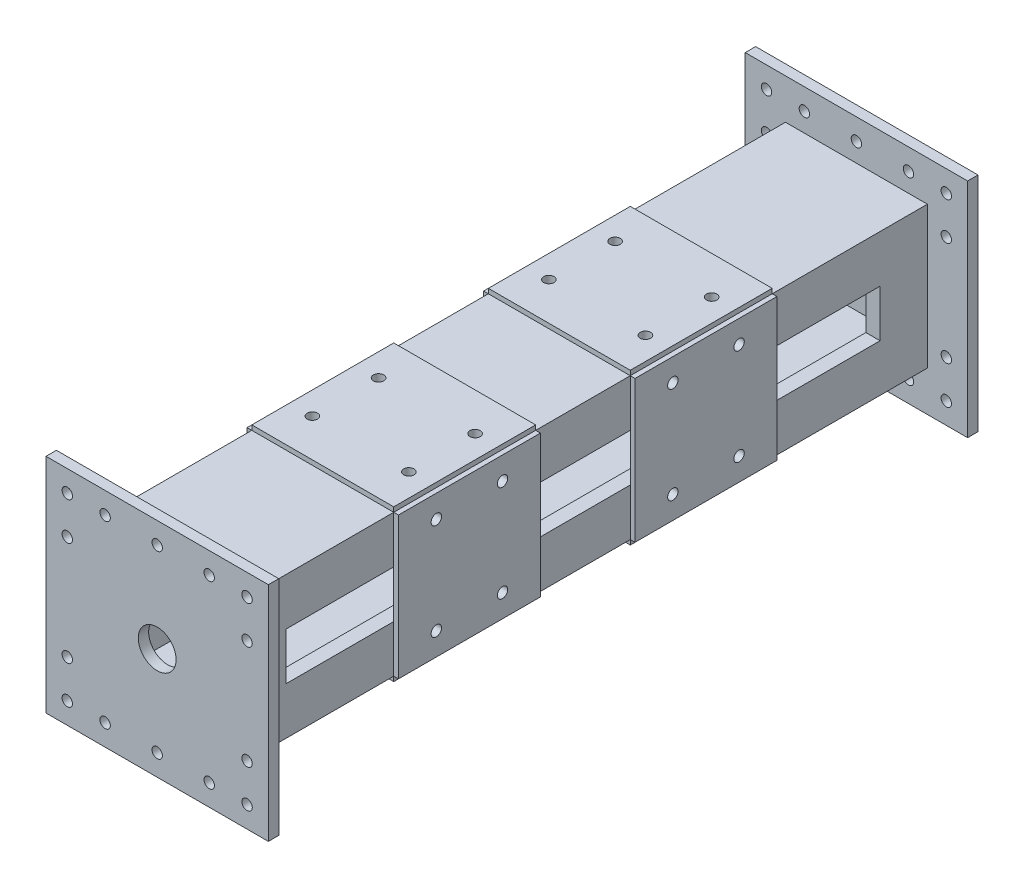
from build123d import *

# Parameters (mm, degrees)
SKETCH_1_W                       = 300
SKETCH_1_H                       = 300
EXTRUDE_1_DEPTH                  = 1456
SKETCH_2_W                       = 240
SKETCH_2_H                       = 240
CUT_EXTRUDE_1_DEPTH              = 1517.553988488
SKETCH_4_W                       = 1256
SKETCH_4_H                       = 100
CUT_EXTRUDE_2_DEPTH              = 1517.553988488
SKETCH_5_W                       = 470
SKETCH_5_H                       = 470
EXTRUDE_2_DEPTH                  = 22
SKETCH_6_W                       = 470
SKETCH_6_H                       = 470
EXTRUDE_3_DEPTH                  = 22
SKETCH_7_R                       = 11
CUT_EXTRUDE_3_DEPTH              = 1596.760007019
SKETCH_8_W                       = 300
SKETCH_8_H                       = 300
EXTRUDE_4_DEPTH                  = 10
SKETCH_9_W                       = 300
SKETCH_9_H                       = 300
EXTRUDE_5_DEPTH                  = 10
SKETCH_10_W                      = 300
SKETCH_10_H                      = 300
EXTRUDE_6_DEPTH                  = 10
SKETCH_11_W                      = 300
SKETCH_11_H                      = 300
EXTRUDE_7_DEPTH                  = 10
SKETCH_12_R                      = 11
CUT_EXTRUDE_4_DEPTH              = 1578.572185353
PATTERN_LINEAR_1_COUNT           = 2
PATTERN_LINEAR_1_PITCH           = 140
PATTERN_LINEAR_1_COUNT_DIR2      = 2
PATTERN_LINEAR_1_PITCH_DIR2      = 204
PATTERN_LINEAR_2_COUNT           = 2
PATTERN_LINEAR_2_PITCH           = 500
PATTERN_LINEAR_2_COPY_1_SKETCH_R = 11
PATTERN_LINEAR_2_COPY_1_DEPTH    = 1578.572185353
PATTERN_LINEAR_2_COPY_2_SKETCH_R = 11
PATTERN_LINEAR_2_COPY_2_DEPTH    = 1578.572185353
PATTERN_LINEAR_2_COPY_3_SKETCH_R = 11
PATTERN_LINEAR_2_COPY_3_DEPTH    = 1578.572185353
SKETCH_13_R                      = 11
CUT_EXTRUDE_5_DEPTH              = 1578.572185353
PATTERN_LINEAR_3_COUNT           = 2
PATTERN_LINEAR_3_PITCH           = 140
PATTERN_LINEAR_3_COUNT_DIR2      = 2
PATTERN_LINEAR_3_PITCH_DIR2      = 204
PATTERN_LINEAR_4_COUNT           = 2
PATTERN_LINEAR_4_PITCH           = 500
PATTERN_LINEAR_4_COPY_1_SKETCH_R = 11
PATTERN_LINEAR_4_COPY_1_DEPTH    = 1578.572185353
PATTERN_LINEAR_4_COPY_2_SKETCH_R = 11
PATTERN_LINEAR_4_COPY_2_DEPTH    = 1578.572185353
PATTERN_LINEAR_4_COPY_3_SKETCH_R = 11
PATTERN_LINEAR_4_COPY_3_DEPTH    = 1578.572185353
SKETCH_14_R                      = 40
CUT_EXTRUDE_6_DEPTH              = 1596.760007019


with BuildPart() as part:
    # 草图1 → 拉伸1 (new body)
    with BuildSketch(Plane.XY):
        with Locations((150, 150)):
            Rectangle(SKETCH_1_W, SKETCH_1_H)
    extrude(amount=EXTRUDE_1_DEPTH)

    # 草图2 → 切除-拉伸1 (cut, through all)
    with BuildSketch(Plane.XY.offset(1456)):
        with Locations((150, 150)):
            Rectangle(SKETCH_2_W, SKETCH_2_H)
    extrude(amount=-CUT_EXTRUDE_1_DEPTH, mode=Mode.SUBTRACT)

    # 草图4 → 切除-拉伸2 (cut, through all)
    with BuildSketch(Plane.ZY):
        with Locations((728, 150)):
            Rectangle(SKETCH_4_W, SKETCH_4_H)
    extrude(amount=-CUT_EXTRUDE_2_DEPTH, mode=Mode.SUBTRACT)

    # 草图5 → 拉伸2 (add)
    with BuildSketch(Plane.XY.offset(1456)):
        with Locations((150, 150)):
            Rectangle(SKETCH_5_W, SKETCH_5_H)
    extrude(amount=EXTRUDE_2_DEPTH)

    # 草图6 → 拉伸3 (add)
    with BuildSketch(Plane(origin=(0, 0, 0), x_dir=(-1, 0, 0), z_dir=(0, 0, -1))):
        with Locations((-150, 150)):
            Rectangle(SKETCH_6_W, SKETCH_6_H)
    extrude(amount=EXTRUDE_3_DEPTH)

    # 草图7 → 切除-拉伸3 (cut, through all)
    with BuildSketch(Plane.XY.offset(1478)):
        with Locations((-40, -40)):
            Circle(SKETCH_7_R)
        with Locations((40, -40)):
            Circle(SKETCH_7_R)
        with Locations((150, -40)):
            Circle(SKETCH_7_R)
        with Locations((260, -40)):
            Circle(SKETCH_7_R)
        with Locations((340, -40)):
            Circle(SKETCH_7_R)
        with Locations((-40, 340)):
            Circle(SKETCH_7_R)
        with Locations((40, 340)):
            Circle(SKETCH_7_R)
        with Locations((150, 340)):
            Circle(SKETCH_7_R)
        with Locations((260, 340)):
            Circle(SKETCH_7_R)
        with Locations((340, 340)):
            Circle(SKETCH_7_R)
        with Locations((-40, 40)):
            Circle(SKETCH_7_R)
        with Locations((-40, 260)):
            Circle(SKETCH_7_R)
        with Locations((340, 40)):
            Circle(SKETCH_7_R)
        with Locations((340, 260)):
            Circle(SKETCH_7_R)
    extrude(amount=-CUT_EXTRUDE_3_DEPTH, mode=Mode.SUBTRACT)

    # 草图8 → 拉伸4 (add)
    with BuildSketch(Plane(origin=(0, 300, 0), x_dir=(1, 0, 0), z_dir=(0, 1, 0))):
        with Locations((150, -478)):
            Rectangle(SKETCH_8_W, SKETCH_8_H)
        with Locations((150, -978)):
            Rectangle(SKETCH_8_W, SKETCH_8_H)
    extrude(amount=EXTRUDE_4_DEPTH)

    # 草图9 → 拉伸5 (add)
    with BuildSketch(Plane.XZ):
        with Locations((150, 478)):
            Rectangle(SKETCH_9_W, SKETCH_9_H)
        with Locations((150, 978)):
            Rectangle(SKETCH_9_W, SKETCH_9_H)
    extrude(amount=EXTRUDE_5_DEPTH)

    # 草图10 → 拉伸6 (add)
    with BuildSketch(Plane(origin=(300, 0, 0), x_dir=(0, 0, -1), z_dir=(1, 0, 0))):
        with Locations((-478, 150)):
            Rectangle(SKETCH_10_W, SKETCH_10_H)
        with Locations((-978, 150)):
            Rectangle(SKETCH_10_W, SKETCH_10_H)
    extrude(amount=EXTRUDE_6_DEPTH)

    # 草图11 → 拉伸7 (add)
    with BuildSketch(Plane.ZY):
        with Locations((478, 150)):
            Rectangle(SKETCH_11_W, SKETCH_11_H)
        with Locations((978, 150)):
            Rectangle(SKETCH_11_W, SKETCH_11_H)
    extrude(amount=EXTRUDE_7_DEPTH)

    # 草图12 → 切除-拉伸4 (cut, through all)
    with BuildSketch(Plane.ZY.offset(10)):
        with Locations((1048, 252)):
            Circle(SKETCH_12_R)
    cut_extrude_4 = extrude(amount=-CUT_EXTRUDE_4_DEPTH, mode=Mode.SUBTRACT)

    # 阵列(线性)1: Cut-Extrude 4 2 × 2
    with Locations(*[(0, -j * PATTERN_LINEAR_1_PITCH_DIR2, -i * PATTERN_LINEAR_1_PITCH) for i in range(PATTERN_LINEAR_1_COUNT) for j in range(PATTERN_LINEAR_1_COUNT_DIR2) if (i, j) != (0, 0)]):
        add(cut_extrude_4, mode=Mode.SUBTRACT)

    # 阵列(线性)2: 切除-拉伸4 ×2
    with Locations(*[(0, 0, -i * PATTERN_LINEAR_2_PITCH) for i in range(1, PATTERN_LINEAR_2_COUNT)]):
        add(cut_extrude_4, mode=Mode.SUBTRACT)

    # 阵列(线性)2 copy 1 sketch → 阵列(线性)2 copy 1 (cut, through all)
    with BuildSketch(Plane(origin=(-10, -204, -500), x_dir=(0, 0, 1), z_dir=(-1, 0, 0))):
        with Locations((1048, 252)):
            Circle(PATTERN_LINEAR_2_COPY_1_SKETCH_R)
    extrude(amount=-PATTERN_LINEAR_2_COPY_1_DEPTH, mode=Mode.SUBTRACT)

    # 阵列(线性)2 copy 2 sketch → 阵列(线性)2 copy 2 (cut, through all)
    with BuildSketch(Plane(origin=(-10, 0, -640), x_dir=(0, 0, 1), z_dir=(-1, 0, 0))):
        with Locations((1048, 252)):
            Circle(PATTERN_LINEAR_2_COPY_2_SKETCH_R)
    extrude(amount=-PATTERN_LINEAR_2_COPY_2_DEPTH, mode=Mode.SUBTRACT)

    # 阵列(线性)2 copy 3 sketch → 阵列(线性)2 copy 3 (cut, through all)
    with BuildSketch(Plane(origin=(-10, -204, -640), x_dir=(0, 0, 1), z_dir=(-1, 0, 0))):
        with Locations((1048, 252)):
            Circle(PATTERN_LINEAR_2_COPY_3_SKETCH_R)
    extrude(amount=-PATTERN_LINEAR_2_COPY_3_DEPTH, mode=Mode.SUBTRACT)

    # 草图13 → 切除-拉伸5 (cut, through all)
    with BuildSketch(Plane.XZ.offset(10)):
        with Locations(Location((48, 1048, 0), (0, 0, 270))):
            Circle(SKETCH_13_R)
    cut_extrude_5 = extrude(amount=-CUT_EXTRUDE_5_DEPTH, mode=Mode.SUBTRACT)

    # 阵列(线性)3: Cut-Extrude 5 2 × 2
    with Locations(*[(j * PATTERN_LINEAR_3_PITCH_DIR2, 0, -i * PATTERN_LINEAR_3_PITCH) for i in range(PATTERN_LINEAR_3_COUNT) for j in range(PATTERN_LINEAR_3_COUNT_DIR2) if (i, j) != (0, 0)]):
        add(cut_extrude_5, mode=Mode.SUBTRACT)

    # 阵列(线性)4: 切除-拉伸5 ×2
    with Locations(*[(0, 0, -i * PATTERN_LINEAR_4_PITCH) for i in range(1, PATTERN_LINEAR_4_COUNT)]):
        add(cut_extrude_5, mode=Mode.SUBTRACT)

    # 阵列(线性)4 copy 1 sketch → 阵列(线性)4 copy 1 (cut, through all)
    with BuildSketch(Plane(origin=(204, -10, -500), x_dir=(1, 0, 0), z_dir=(0, -1, 0))):
        with Locations(Location((48, 1048, 0), (0, 0, 270))):
            Circle(PATTERN_LINEAR_4_COPY_1_SKETCH_R)
    extrude(amount=-PATTERN_LINEAR_4_COPY_1_DEPTH, mode=Mode.SUBTRACT)

    # 阵列(线性)4 copy 2 sketch → 阵列(线性)4 copy 2 (cut, through all)
    with BuildSketch(Plane(origin=(0, -10, -640), x_dir=(1, 0, 0), z_dir=(0, -1, 0))):
        with Locations(Location((48, 1048, 0), (0, 0, 270))):
            Circle(PATTERN_LINEAR_4_COPY_2_SKETCH_R)
    extrude(amount=-PATTERN_LINEAR_4_COPY_2_DEPTH, mode=Mode.SUBTRACT)

    # 阵列(线性)4 copy 3 sketch → 阵列(线性)4 copy 3 (cut, through all)
    with BuildSketch(Plane(origin=(204, -10, -640), x_dir=(1, 0, 0), z_dir=(0, -1, 0))):
        with Locations(Location((48, 1048, 0), (0, 0, 270))):
            Circle(PATTERN_LINEAR_4_COPY_3_SKETCH_R)
    extrude(amount=-PATTERN_LINEAR_4_COPY_3_DEPTH, mode=Mode.SUBTRACT)

    # 草图14 → 切除-拉伸6 (cut, through all)
    with BuildSketch(Plane.XY.offset(1478)):
        with Locations((150, 150)):
            Circle(SKETCH_14_R)
    extrude(amount=-CUT_EXTRUDE_6_DEPTH, mode=Mode.SUBTRACT)


solid = part.part
